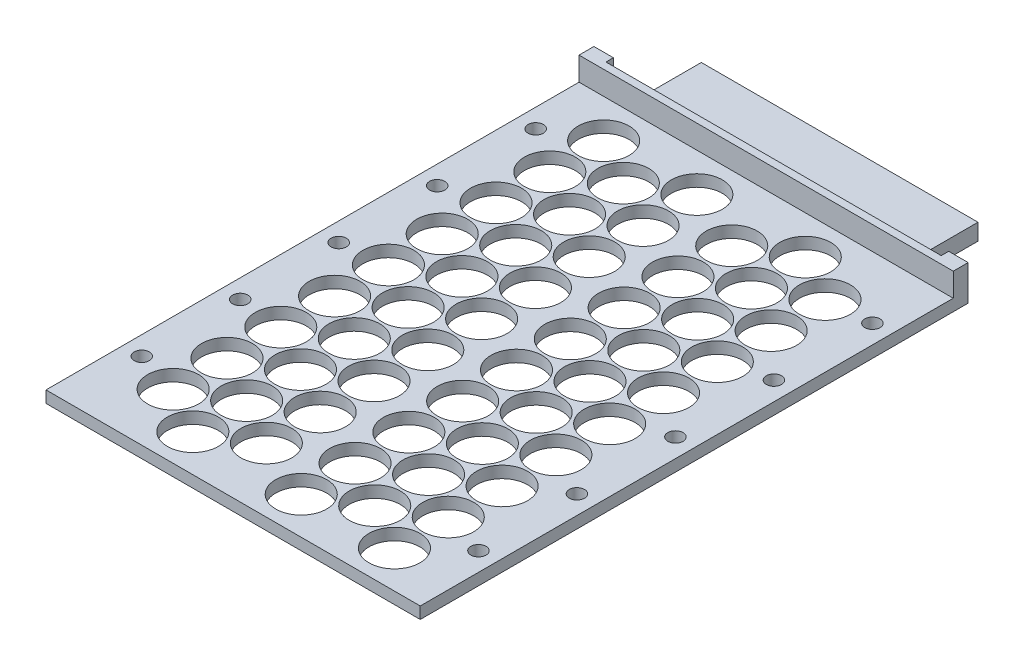
from build123d import *

# Parameters (mm, degrees)
CELL_BLOCK_SKETCH_W = 127.601132068
CELL_BLOCK_SKETCH_H = 233.675
BOSS_EXTRUDE1_DEPTH = 5
SKETCH3_W           = 16
SKETCH3_H           = 233.675
BOSS_EXTRUDE3_DEPTH = 5
SKETCH4_R           = 3.25
CUT_EXTRUDE3_DEPTH  = 5
SKETCH6_R           = 10.875
CUT_EXTRUDE4_DEPTH  = 5
BOSS_EXTRUDE4_DEPTH = 10
SKETCH8_W           = 143
SKETCH8_H           = 3.175
BOSS_EXTRUDE5_DEPTH = 5
SKETCH9_W           = 118
SKETCH9_H           = 7
BOSS_EXTRUDE6_DEPTH = 25


with BuildPart() as part:
    # Cell Block Sketch → Boss-Extrude1 (new body)
    with BuildSketch(Plane(origin=(0, 0, 0), x_dir=(1, 0, 0), z_dir=(0, 1, 0))):
        Rectangle(CELL_BLOCK_SKETCH_W, CELL_BLOCK_SKETCH_H)
    extrude(amount=BOSS_EXTRUDE1_DEPTH)

    # Sketch3 → Boss-Extrude3 (add)
    with BuildSketch(Plane(origin=(0, 0, 0), x_dir=(1, 0, 0), z_dir=(0, 1, 0))):
        with Locations((-71.800566034, 0)):
            Rectangle(SKETCH3_W, SKETCH3_H)
    boss_extrude3 = extrude(amount=BOSS_EXTRUDE3_DEPTH)

    # Mirror1: Boss-Extrude3 across plane
    add(boss_extrude3.mirror(Plane(origin=(0, 0, 0), x_dir=(0, 0, 1), z_dir=(1, 0, 0))))

    # Sketch4 → Cut-Extrude3 (cut)
    with BuildSketch(Plane(origin=(0, 5, 0), x_dir=(1, 0, 0), z_dir=(0, 1, 0))):
        with Locations(Location((-71.800566034, 0, 0), (0, 0, 270))):
            Circle(SKETCH4_R)
        with Locations(Location((-71.800566034, -42, 0), (0, 0, 270))):
            Circle(SKETCH4_R)
        with Locations(Location((-71.800566034, -84, 0), (0, 0, 270))):
            Circle(SKETCH4_R)
        with Locations(Location((-71.800566034, 42, 0), (0, 0, 270))):
            Circle(SKETCH4_R)
        with Locations(Location((-71.800566034, 84, 0), (0, 0, 270))):
            Circle(SKETCH4_R)
    cut_extrude3 = extrude(amount=-CUT_EXTRUDE3_DEPTH, mode=Mode.SUBTRACT)

    # Mirror2: Cut-Extrude3 across plane
    add(cut_extrude3.mirror(Plane(origin=(0, 0, 0), x_dir=(0, 0, 1), z_dir=(1, 0, 0))), mode=Mode.SUBTRACT)

    # Sketch6 → Cut-Extrude4 (cut)
    with BuildSketch(Plane(origin=(0, 5, 0), x_dir=(1, 0, 0), z_dir=(0, 1, 0))):
        with Locations(Location((-33.050283017, 82.6375, 0), (0, 0, 270))):
            Circle(SKETCH6_R)
        with Locations(Location((-52.925566034, 94.1125, 0), (0, 0, 270))):
            Circle(SKETCH6_R)
        with Locations(Location((-13.175, 94.1125, 0), (0, 0, 270))):
            Circle(SKETCH6_R)
        with Locations(Location((-52.925566034, 71.1625, 0), (0, 0, 270))):
            Circle(SKETCH6_R)
        with Locations(Location((-33.050283017, 59.6875, 0), (0, 0, 270))):
            Circle(SKETCH6_R)
        with Locations(Location((-13.175, 71.1625, 0), (0, 0, 270))):
            Circle(SKETCH6_R)
        with Locations(Location((-52.925566034, 48.2125, 0), (0, 0, 270))):
            Circle(SKETCH6_R)
        with Locations(Location((-33.050283017, 36.7375, 0), (0, 0, 270))):
            Circle(SKETCH6_R)
        with Locations(Location((-13.175, 48.2125, 0), (0, 0, 270))):
            Circle(SKETCH6_R)
        with Locations(Location((-52.925566034, 25.2625, 0), (0, 0, 270))):
            Circle(SKETCH6_R)
        with Locations(Location((-33.050283017, 13.7875, 0), (0, 0, 270))):
            Circle(SKETCH6_R)
        with Locations(Location((-13.175, 25.2625, 0), (0, 0, 270))):
            Circle(SKETCH6_R)
        with Locations(Location((-52.925566034, 2.3125, 0), (0, 0, 270))):
            Circle(SKETCH6_R)
        with Locations(Location((-33.050283017, -9.1625, 0), (0, 0, 270))):
            Circle(SKETCH6_R)
        with Locations(Location((-13.175, 2.3125, 0), (0, 0, 270))):
            Circle(SKETCH6_R)
        with Locations(Location((-52.925566034, -20.6375, 0), (0, 0, 270))):
            Circle(SKETCH6_R)
        with Locations(Location((-33.050283017, -32.1125, 0), (0, 0, 270))):
            Circle(SKETCH6_R)
        with Locations(Location((-13.175, -20.6375, 0), (0, 0, 270))):
            Circle(SKETCH6_R)
        with Locations(Location((-52.925566034, -43.5875, 0), (0, 0, 270))):
            Circle(SKETCH6_R)
        with Locations(Location((-33.050283017, -55.0625, 0), (0, 0, 270))):
            Circle(SKETCH6_R)
        with Locations(Location((-13.175, -43.5875, 0), (0, 0, 270))):
            Circle(SKETCH6_R)
        with Locations(Location((-52.925566034, -66.5375, 0), (0, 0, 270))):
            Circle(SKETCH6_R)
        with Locations(Location((-33.050283017, -78.0125, 0), (0, 0, 270))):
            Circle(SKETCH6_R)
        with Locations(Location((-13.175, -66.5375, 0), (0, 0, 270))):
            Circle(SKETCH6_R)
        with Locations(Location((-52.925566034, -89.4875, 0), (0, 0, 270))):
            Circle(SKETCH6_R)
        with Locations(Location((-33.050283017, -100.9625, 0), (0, 0, 270))):
            Circle(SKETCH6_R)
        with Locations(Location((-13.175, -89.4875, 0), (0, 0, 270))):
            Circle(SKETCH6_R)
        with Locations(Location((33.050283017, 94.1125, 0), (0, 0, 270))):
            Circle(SKETCH6_R)
        with Locations(Location((13.175, 82.6375, 0), (0, 0, 270))):
            Circle(SKETCH6_R)
        with Locations(Location((52.925566034, 82.6375, 0), (0, 0, 270))):
            Circle(SKETCH6_R)
        with Locations(Location((13.175, 59.6875, 0), (0, 0, 270))):
            Circle(SKETCH6_R)
        with Locations(Location((33.050283017, 71.1625, 0), (0, 0, 270))):
            Circle(SKETCH6_R)
        with Locations(Location((52.925566034, 59.6875, 0), (0, 0, 270))):
            Circle(SKETCH6_R)
        with Locations(Location((13.175, 36.7375, 0), (0, 0, 270))):
            Circle(SKETCH6_R)
        with Locations(Location((33.050283017, 48.2125, 0), (0, 0, 270))):
            Circle(SKETCH6_R)
        with Locations(Location((52.925566034, 36.7375, 0), (0, 0, 270))):
            Circle(SKETCH6_R)
        with Locations(Location((13.175, 13.7875, 0), (0, 0, 270))):
            Circle(SKETCH6_R)
        with Locations(Location((33.050283017, 25.2625, 0), (0, 0, 270))):
            Circle(SKETCH6_R)
        with Locations(Location((52.925566034, 13.7875, 0), (0, 0, 270))):
            Circle(SKETCH6_R)
        with Locations(Location((13.175, -9.1625, 0), (0, 0, 270))):
            Circle(SKETCH6_R)
        with Locations(Location((33.050283017, 2.3125, 0), (0, 0, 270))):
            Circle(SKETCH6_R)
        with Locations(Location((52.925566034, -9.1625, 0), (0, 0, 270))):
            Circle(SKETCH6_R)
        with Locations(Location((13.175, -32.1125, 0), (0, 0, 270))):
            Circle(SKETCH6_R)
        with Locations(Location((33.050283017, -20.6375, 0), (0, 0, 270))):
            Circle(SKETCH6_R)
        with Locations(Location((52.925566034, -32.1125, 0), (0, 0, 270))):
            Circle(SKETCH6_R)
        with Locations(Location((13.175, -55.0625, 0), (0, 0, 270))):
            Circle(SKETCH6_R)
        with Locations(Location((33.050283017, -43.5875, 0), (0, 0, 270))):
            Circle(SKETCH6_R)
        with Locations(Location((52.925566034, -55.0625, 0), (0, 0, 270))):
            Circle(SKETCH6_R)
        with Locations(Location((13.175, -78.0125, 0), (0, 0, 270))):
            Circle(SKETCH6_R)
        with Locations(Location((33.050283017, -66.5375, 0), (0, 0, 270))):
            Circle(SKETCH6_R)
        with Locations(Location((52.925566034, -78.0125, 0), (0, 0, 270))):
            Circle(SKETCH6_R)
        with Locations(Location((13.175, -100.9625, 0), (0, 0, 270))):
            Circle(SKETCH6_R)
        with Locations(Location((33.050283017, -89.4875, 0), (0, 0, 270))):
            Circle(SKETCH6_R)
        with Locations(Location((52.925566034, -100.9625, 0), (0, 0, 270))):
            Circle(SKETCH6_R)
    extrude(amount=-CUT_EXTRUDE4_DEPTH, mode=Mode.SUBTRACT)

    # Sketch7 → Boss-Extrude4 (add)
    with BuildSketch(Plane(origin=(0, 5, 0), x_dir=(1, 0, 0), z_dir=(0, 1, 0))):
        Polygon((-79.800566034, 116.8375), (-79.800566034, 110.4875), (79.800566034, 110.4875), (79.800566034, 116.8375), (71.5, 116.8375), (71.5, 113.6625), (-71.5, 113.6625), (-71.5, 116.8375), align=None)
    extrude(amount=BOSS_EXTRUDE4_DEPTH)

    # Sketch8 → Boss-Extrude5 (add)
    with BuildSketch(Plane(origin=(0, 5, 0), x_dir=(1, 0, 0), z_dir=(0, 1, 0))):
        with Locations((0, 115.25)):
            Rectangle(SKETCH8_W, SKETCH8_H)
    extrude(amount=BOSS_EXTRUDE5_DEPTH)

    # Sketch9 → Boss-Extrude6 (add)
    with BuildSketch(Plane(origin=(0, 0, -116.8375), x_dir=(-1, 0, 0), z_dir=(0, 0, -1))):
        with Locations((0, 3.5)):
            Rectangle(SKETCH9_W, SKETCH9_H)
    extrude(amount=BOSS_EXTRUDE6_DEPTH)


solid = part.part
